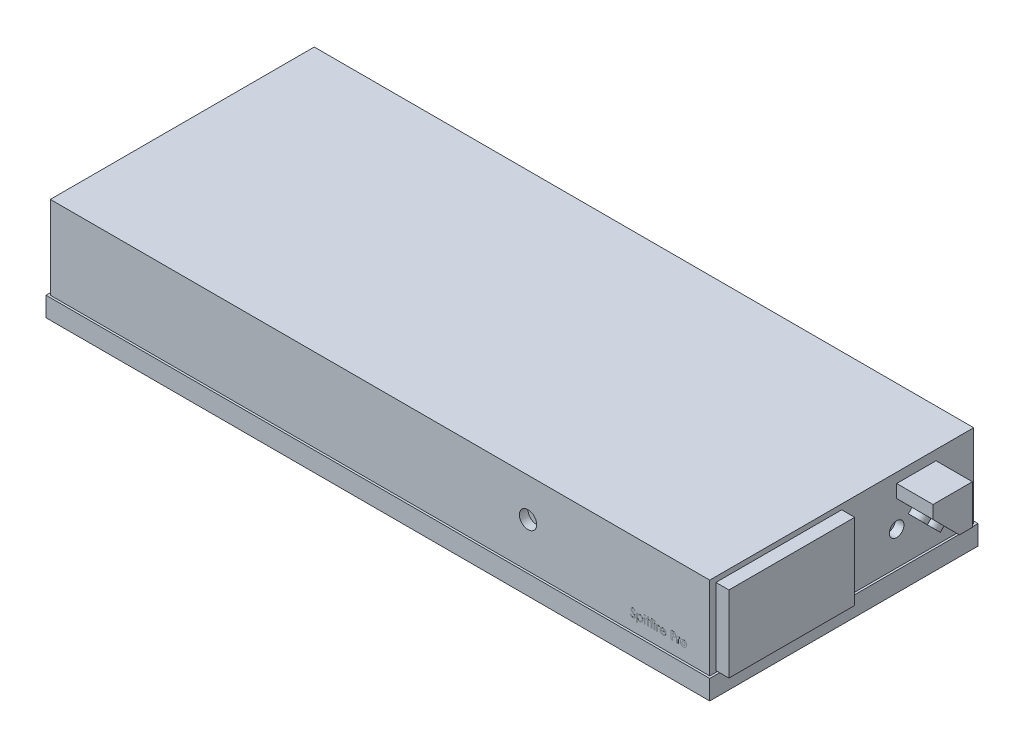
from build123d import *

# Parameters (mm, degrees)
SKETCH_1_W          = 1524
SKETCH_1_H          = 610
EXTRUDE_1_DEPTH     = 237
EXTRUDE_2_DEPTH     = 84
SKETCH_6_R          = 16.880553736
CUT_EXTRUDE_1_DEPTH = 20
SKETCH_7_R          = 20
CUT_EXTRUDE_2_DEPTH = 20
SKETCH_8_W          = 290.679557704
SKETCH_8_H          = 176.432368358
EXTRUDE_3_DEPTH     = 30
SKETCH_9_R          = 18
EXTRUDE_4_DEPTH     = 12
SKETCH_10_W         = 610
SKETCH_10_H         = 45.193860384
EXTRUDE_6_DEPTH     = 5
SKETCH_11_W         = 160
SKETCH_11_H         = 100
EXTRUDE_7_DEPTH     = 20
SKETCH_12_R         = 16
CUT_EXTRUDE_3_DEPTH = 20
SKETCH_13_W         = 610
SKETCH_13_H         = 45.193860384
EXTRUDE_8_DEPTH     = 5
SKETCH_14_W         = 1534
SKETCH_14_H         = 45.193860384
EXTRUDE_9_DEPTH     = 5
SKETCH_15_W         = 1534
SKETCH_15_H         = 45.193860384
EXTRUDE_10_DEPTH    = 5
SKETCH_17_W         = 1.709615384
SKETCH_17_H         = 13.921153846
SKETCH_17_W_2       = 1.709615385
EXTRUDE_11_DEPTH    = 0.1


with BuildPart() as part:
    # 스케치1 → 보스-돌출1 (new body)
    with BuildSketch(Plane(origin=(0, 0, 0), x_dir=(1, 0, 0), z_dir=(0, 1, 0))):
        Rectangle(SKETCH_1_W, SKETCH_1_H)
    extrude(amount=EXTRUDE_1_DEPTH)

    # 스케치2 → 보스-돌출2 (add)
    with BuildSketch(Plane(origin=(762, 0, 0), x_dir=(0, 0, -1), z_dir=(1, 0, 0))):
        Polygon((127, 184.308560686), (127, 214.308560686), (218, 214.308560686), (218, 123), (188, 123), align=None)
    extrude(amount=EXTRUDE_2_DEPTH)

    # 스케치6 → 컷-돌출1 (cut)
    with BuildSketch(Plane(origin=(762, 0, 0), x_dir=(0, 0, -1), z_dir=(1, 0, 0))):
        with Locations((127, 123)):
            Circle(SKETCH_6_R)
    extrude(amount=-CUT_EXTRUDE_1_DEPTH, mode=Mode.SUBTRACT)

    # 스케치7 → 컷-돌출2 (cut)
    with BuildSketch(Plane.XY.offset(305)):
        with Locations((342, 148)):
            Circle(SKETCH_7_R)
    extrude(amount=-CUT_EXTRUDE_2_DEPTH, mode=Mode.SUBTRACT)

    # 스케치8 → 보스-돌출3 (add)
    with BuildSketch(Plane(origin=(762, 0, 0), x_dir=(0, 0, -1), z_dir=(1, 0, 0))):
        with Locations((-145.339778852, 136.93862866)):
            Rectangle(SKETCH_8_W, SKETCH_8_H)
    extrude(amount=EXTRUDE_3_DEPTH)

    # 스케치9 → 보스-돌출4 (add)
    with BuildSketch(Plane(origin=(0, 155.188500395, -155.973501545), x_dir=(1, 0, 0), z_dir=(0, -0.7053206439265453, 0.7088884180539583))):
        with Locations(Location((804, 19.07848224, 0), (0, 0, 90))):
            Circle(SKETCH_9_R)
        with Locations(Location((804, -23.407005638, 0), (0, 0, 90))):
            Circle(SKETCH_9_R)
    extrude(amount=EXTRUDE_4_DEPTH)

    # 스케치10 → 보스-돌출6 (add)
    with BuildSketch(Plane(origin=(762, 0, 0), x_dir=(0, 0, -1), z_dir=(1, 0, 0))):
        with Locations((0, 22.596930192)):
            Rectangle(SKETCH_10_W, SKETCH_10_H)
    extrude(amount=EXTRUDE_6_DEPTH)

    # 스케치11 → 보스-돌출7 (add)
    with BuildSketch(Plane.ZY.offset(762)):
        with Locations((89, 161)):
            Rectangle(SKETCH_11_W, SKETCH_11_H)
    extrude(amount=EXTRUDE_7_DEPTH)

    # 스케치12 → 컷-돌출3 (cut)
    with BuildSketch(Plane.ZY.offset(782)):
        with Locations((89, 161)):
            Circle(SKETCH_12_R)
    extrude(amount=-CUT_EXTRUDE_3_DEPTH, mode=Mode.SUBTRACT)

    # 스케치13 → 보스-돌출8 (add)
    with BuildSketch(Plane.ZY.offset(762)):
        with Locations((0, 22.596930192)):
            Rectangle(SKETCH_13_W, SKETCH_13_H)
    extrude(amount=EXTRUDE_8_DEPTH)

    # 스케치14 → 보스-돌출9 (add)
    with BuildSketch(Plane.XY.offset(305)):
        with Locations((0, 22.596930192)):
            Rectangle(SKETCH_14_W, SKETCH_14_H)
    extrude(amount=EXTRUDE_9_DEPTH)

    # 스케치15 → 보스-돌출10 (add)
    with BuildSketch(Plane(origin=(0, 0, -305), x_dir=(-1, 0, 0), z_dir=(0, 0, -1))):
        with Locations((0, 22.596930192)):
            Rectangle(SKETCH_15_W, SKETCH_15_H)
    extrude(amount=EXTRUDE_10_DEPTH)

    # 스케치17 → 보스-돌출11 (add)
    # profile 1 of 13: a face of its own
    with BuildSketch(Plane.XY.offset(305)):
        with BuildLine():
            Line((578.603701698, 76.91776765), (580.214098333, 77.88324241))
            add(Edge.make_bspline(
                [(580.214098333, 77.88324241), (580.363876167, 77.632520543), (580.650844717, 77.152147122), (581.129551401, 76.503042645), (581.625574817, 75.951342906), (582.14258819, 75.500257371), (582.677435707, 75.145117002), (583.233608914, 74.893644855), (583.80923357, 74.736803617), (584.200976798, 74.717753146), (584.396550256, 74.70824241)],
                knots=[0, 0, 0, 0, 1.272034388, 2.437168799, 3.508375237, 4.49857839, 5.41946034, 6.295179144, 7.148887113, 8, 8, 8, 8], degree=3))
            add(Edge.make_bspline(
                [(584.396550256, 74.70824241), (584.563574454, 74.71289427), (584.894700318, 74.722116595), (585.382174812, 74.810730674), (585.855604336, 74.946868119), (586.30523135, 75.141836332), (586.724851766, 75.377721518), (587.092825351, 75.662634284), (587.410939195, 75.98161949), (587.671157376, 76.337487939), (587.870801568, 76.720214133), (588.024246969, 77.113057525), (588.10940087, 77.522189304), (588.122228342, 77.797654823), (588.128701698, 77.936667891)],
                knots=[0, 0, 0, 0, 1.095163259, 2.171163733, 3.241058638, 4.321873601, 5.38011039, 6.391990106, 7.366004449, 8.327778327, 9.272591725, 10.192022065, 11.087607919, 12, 12, 12, 12], degree=3))
            add(Edge.make_bspline(
                [(588.128701698, 77.936667891), (588.120677236, 78.095277373), (588.104364676, 78.417707272), (587.966489049, 78.893411098), (587.749595291, 79.3641778), (587.549501473, 79.655377546), (587.445618765, 79.806559718)],
                knots=[0, 0, 0, 0, 0.938893495, 1.908633276, 2.914225137, 4, 4, 4, 4], degree=3))
            add(Edge.make_bspline(
                [(587.445618765, 79.806559718), (587.360325851, 79.915671715), (587.181264046, 80.144738704), (586.873429585, 80.485707771), (586.512208306, 80.837416595), (586.109961814, 81.213295176), (585.652037431, 81.595861612), (585.152777674, 82.003358954), (584.599435813, 82.420290394), (584.211362838, 82.69990393), (584.011123573, 82.84417991)],
                knots=[0, 0, 0, 0, 0.722233717, 1.516239348, 2.393582979, 3.351407094, 4.387010283, 5.505090956, 6.712668013, 8, 8, 8, 8], degree=3))
            add(Edge.make_bspline(
                [(584.011123573, 82.84417991), (583.810695823, 82.986938365), (583.427493226, 83.259881661), (582.891597228, 83.664962407), (582.412383793, 84.035315469), (581.99198286, 84.374427306), (581.63057934, 84.682343912), (581.325325346, 84.956108409), (581.083996914, 85.203124647), (580.949800111, 85.363369665), (580.889549054, 85.435315727)],
                knots=[0, 0, 0, 0, 1.452282411, 2.77665338, 3.964542531, 5.026858415, 5.96415736, 6.766646006, 7.446254459, 8, 8, 8, 8], degree=3))
            add(Edge.make_bspline(
                [(580.889549054, 85.435315727), (580.805334201, 85.547444228), (580.639714389, 85.767959973), (580.42109656, 86.112628127), (580.235281973, 86.4654519), (580.089618423, 86.827379392), (579.966957003, 87.193329505), (579.884454552, 87.568076999), (579.832794234, 87.949940337), (579.82750385, 88.206916676), (579.824855544, 88.335556112)],
                knots=[0, 0, 0, 0, 1.068054152, 2.10047183, 3.106115577, 4.101338837, 5.06977816, 6.043150881, 7.020423561, 8, 8, 8, 8], degree=3))
            add(Edge.make_bspline(
                [(579.824855544, 88.335556112), (579.83195961, 88.537103885), (579.846015898, 88.935891489), (579.964890714, 89.518445009), (580.152521749, 90.07463108), (580.415383924, 90.598943325), (580.754241802, 91.077729592), (581.146377749, 91.516497286), (581.613437409, 91.885351997), (582.125896687, 92.207634772), (582.686817798, 92.459889022), (583.274596858, 92.650176643), (583.890168065, 92.757995603), (584.307107983, 92.773468366), (584.51866564, 92.781319333)],
                knots=[0, 0, 0, 0, 1.005424448, 1.989358655, 2.955360095, 3.929531133, 4.905563448, 5.876582895, 6.856512386, 7.866279853, 8.892233794, 9.918561126, 10.94386622, 12, 12, 12, 12], degree=3))
            add(Edge.make_bspline(
                [(584.51866564, 92.781319333), (584.743151386, 92.773576588), (585.189581887, 92.758178739), (585.846258331, 92.62429789), (586.478504516, 92.402769948), (586.987102858, 92.151371681), (587.385154031, 91.900284975), (587.688717047, 91.671577075), (587.996333458, 91.408278269), (588.310484585, 91.10968723), (588.625847317, 90.773064199), (588.947103536, 90.400714592), (589.275004485, 89.99491391), (589.485947095, 89.705220555), (589.594086314, 89.556709958)],
                knots=[0, 0, 0, 0, 1.286793592, 2.559021753, 3.825965368, 5.121522368, 5.803751409, 6.523245864, 7.299691795, 8.125521123, 9.008227632, 9.944561021, 10.946284179, 12, 12, 12, 12], degree=3))
            Line((589.594086314, 89.556709958), (588.048563477, 88.385165487))
            add(Edge.make_bspline(
                [(588.048563477, 88.385165487), (587.955240616, 88.505391073), (587.775522605, 88.736917443), (587.50267497, 89.061155604), (587.245507329, 89.357336728), (586.992140153, 89.614594068), (586.755954816, 89.847015679), (586.526717772, 90.046005213), (586.307727946, 90.213512382), (586.031683046, 90.392275187), (585.684876608, 90.569475585), (585.249532204, 90.719421281), (584.79458405, 90.809528118), (584.484724198, 90.821441921), (584.327860352, 90.827473179)],
                knots=[0, 0, 0, 0, 1.181633172, 2.275549214, 3.290209073, 4.226197932, 5.078386478, 5.862611352, 6.581680152, 7.217281963, 8.414376989, 9.595101626, 10.782541182, 12, 12, 12, 12], degree=3))
            add(Edge.make_bspline(
                [(584.327860352, 90.827473179), (584.131065566, 90.820878069), (583.751565359, 90.808160022), (583.212775645, 90.669258387), (582.727850139, 90.450554262), (582.311185464, 90.144039881), (581.964274203, 89.78088705), (581.713328777, 89.36299071), (581.562288596, 88.901532204), (581.543857559, 88.579632618), (581.534470929, 88.415694333)],
                knots=[0, 0, 0, 0, 1.14458467, 2.207223713, 3.21896685, 4.227309161, 5.202851033, 6.127160689, 7.046193047, 8, 8, 8, 8], degree=3))
            add(Edge.make_bspline(
                [(581.534470929, 88.415694333), (581.536610661, 88.313632714), (581.540893624, 88.109342585), (581.60062788, 87.807528417), (581.677368513, 87.506476699), (581.798976266, 87.207540926), (581.966862847, 86.905493058), (582.187326733, 86.595131886), (582.464984903, 86.273721872), (582.677675499, 86.064676023), (582.789969727, 85.954306112)],
                knots=[0, 0, 0, 0, 0.858281714, 1.717966888, 2.583508476, 3.4729293, 4.427298488, 5.488583878, 6.674047936, 8, 8, 8, 8], degree=3))
            add(Edge.make_bspline(
                [(582.789969727, 85.954306112), (582.831669483, 85.917093157), (582.930738557, 85.828683695), (583.111854667, 85.68394571), (583.35102904, 85.505404906), (583.642016163, 85.284493941), (583.990181375, 85.028236269), (584.395562959, 84.739908465), (584.853642159, 84.410150467), (585.178700016, 84.179604425), (585.350576698, 84.057701545)],
                knots=[0, 0, 0, 0, 0.420754252, 0.999615792, 1.744751191, 2.668019286, 3.750313428, 4.999500688, 6.413464383, 8, 8, 8, 8], degree=3))
            add(Edge.make_bspline(
                [(585.350576698, 84.057701545), (585.557328598, 83.907253573), (585.957674996, 83.615931929), (586.527311252, 83.17824087), (587.043804694, 82.750172301), (587.508968702, 82.334459897), (587.927398732, 81.934256991), (588.294452611, 81.544748823), (588.613870386, 81.168725921), (588.957745846, 80.686638044), (589.309124836, 80.094558143), (589.61088504, 79.36914373), (589.801158331, 78.640909472), (589.826040437, 78.151450547), (589.838317083, 77.90995515)],
                knots=[0, 0, 0, 0, 1.163667725, 2.253281268, 3.268753668, 4.215851969, 5.092017293, 5.902905408, 6.650798638, 7.335211899, 8.59617414, 9.77448103, 10.901945474, 12, 12, 12, 12], degree=3))
            add(Edge.make_bspline(
                [(589.838317083, 77.90995515), (589.834740374, 77.739167192), (589.827656413, 77.400907861), (589.746226297, 76.904219514), (589.626920691, 76.421814352), (589.447103746, 75.959655297), (589.227630556, 75.509287375), (588.949139978, 75.082524374), (588.626336723, 74.669920976), (588.25603866, 74.282479401), (587.850840248, 73.926809392), (587.422576139, 73.610421214), (586.970545368, 73.346615054), (586.49720013, 73.131345471), (586.002431697, 72.962978754), (585.486406474, 72.840988709), (584.948273848, 72.76611834), (584.582511227, 72.758347238), (584.396550256, 72.754396256)],
                knots=[0, 0, 0, 0, 0.983748083, 1.948392443, 2.894712957, 3.844097841, 4.80183111, 5.778335162, 6.776009319, 7.81870978, 8.863265674, 9.881300176, 10.883814829, 11.87499822, 12.874611388, 13.892143829, 14.928324115, 16, 16, 16, 16], degree=3))
            add(Edge.make_bspline(
                [(584.396550256, 72.754396256), (584.25266646, 72.757178545), (583.966710938, 72.762708081), (583.543749329, 72.811591908), (583.129332422, 72.880754857), (582.728660402, 72.990559438), (582.336571061, 73.123784127), (581.954769685, 73.287822766), (581.583071234, 73.484403534), (581.219392676, 73.709166454), (580.864658955, 73.970737892), (580.522197279, 74.275393637), (580.180771284, 74.614731314), (579.850458455, 74.997965952), (579.524577484, 75.418906089), (579.209553569, 75.881490073), (578.898865934, 76.383198241), (578.70392746, 76.736249636), (578.603701698, 76.91776765)],
                knots=[0, 0, 0, 0, 0.915332311, 1.819136955, 2.706846663, 3.586547465, 4.459518054, 5.340707479, 6.227863349, 7.133153174, 8.059268498, 9.028702269, 10.047606654, 11.120612155, 12.245963614, 13.433783089, 14.680604001, 16, 16, 16, 16], degree=3))
        make_face()
    # profile 2 of 13: a face of its own
    with BuildSketch(Plane.XY.offset(305)):
        with BuildLine():
            Line((593.257547852, 87.164011641), (594.967163237, 87.164011641))
            Line((594.967163237, 87.164011641), (594.967163237, 84.588140247))
            add(Edge.make_bspline(
                [(594.967163237, 84.588140247), (595.148723257, 84.821844198), (595.501548822, 85.276001058), (596.109651519, 85.8637759), (596.751510293, 86.359485767), (597.443642581, 86.748010697), (598.175291523, 87.040949687), (598.943454565, 87.25746355), (599.754651271, 87.385052148), (600.309259106, 87.400410047), (600.59210314, 87.40824241)],
                knots=[0, 0, 0, 0, 1.0828784, 2.104357462, 3.088488658, 4.04616522, 5.001424249, 5.969181776, 6.964304535, 8, 8, 8, 8], degree=3))
            add(Edge.make_bspline(
                [(600.59210314, 87.40824241), (600.839163152, 87.401094965), (601.327490244, 87.386967664), (602.046291533, 87.291320039), (602.738488978, 87.127393741), (603.400166529, 86.891168759), (604.038412641, 86.599129701), (604.643778641, 86.23055555), (605.225693851, 85.803801855), (605.769523395, 85.312681148), (606.272015409, 84.781304441), (606.706606766, 84.209683043), (607.081466703, 83.616615251), (607.384472174, 82.992906863), (607.621826179, 82.343469341), (607.790634638, 81.665678827), (607.891096955, 80.962048351), (607.904575928, 80.483606401), (607.911394006, 80.241595775)],
                knots=[0, 0, 0, 0, 1.041296284, 2.058176809, 3.050446431, 4.034000596, 5.01514041, 6.003636468, 7.015969324, 8.052561599, 9.08815499, 10.094063707, 11.074456064, 12.040834395, 13.011057502, 13.983766392, 14.980127149, 16, 16, 16, 16], degree=3))
            add(Edge.make_bspline(
                [(607.911394006, 80.241595775), (607.904723863, 79.994477496), (607.891569379, 79.507124587), (607.789542989, 78.791459101), (607.626492003, 78.103006395), (607.392132463, 77.442911574), (607.089283791, 76.81162913), (606.720777541, 76.209614317), (606.285966913, 75.637060018), (605.789027918, 75.101739233), (605.249896937, 74.608620116), (604.673620887, 74.177338623), (604.069143021, 73.815163423), (603.43955594, 73.512633315), (602.779469965, 73.284620141), (602.091964839, 73.120148969), (601.37741487, 73.018724071), (600.891361457, 73.00537741), (600.645528621, 72.998627025)],
                knots=[0, 0, 0, 0, 1.038740735, 2.04854663, 3.033179607, 4.009277356, 4.987731542, 5.972001279, 6.972200261, 8.005528982, 9.039189865, 10.040446548, 11.026516639, 11.997840187, 12.972163198, 13.956796175, 14.96660207, 16, 16, 16, 16], degree=3))
            add(Edge.make_bspline(
                [(600.645528621, 72.998627025), (600.368881408, 73.005674479), (599.822422056, 73.019595265), (599.023423307, 73.160670912), (598.254473584, 73.371510519), (597.524092096, 73.680115041), (596.826493002, 74.073391492), (596.165622345, 74.552962756), (595.537969732, 75.11782587), (595.160187782, 75.546351898), (594.967163237, 75.765303708)],
                knots=[0, 0, 0, 0, 1.014726462, 2.004382257, 2.969841629, 3.936926163, 4.907207904, 5.903978561, 6.929055279, 8, 8, 8, 8], degree=3))
            Line((594.967163237, 75.765303708), (594.967163237, 68.114011641))
            Line((594.967163237, 68.114011641), (593.257547852, 68.114011641))
            Line((593.257547852, 68.114011641), (593.257547852, 87.164011641))
        make_face()
        with BuildLine():
            add(Edge.make_bspline(
                [(600.576838717, 85.698627025), (600.383184242, 85.695142191), (600.001928494, 85.688281452), (599.443098273, 85.606780387), (598.904824588, 85.488464967), (598.392532253, 85.309330196), (597.90131104, 85.089445227), (597.434944372, 84.814678852), (596.993759611, 84.490001506), (596.578866774, 84.121632506), (596.204053706, 83.715733132), (595.872241198, 83.282548056), (595.593527151, 82.822625868), (595.362194727, 82.34025068), (595.18615486, 81.831641343), (595.061210156, 81.299694516), (594.982667807, 80.743827967), (594.972386592, 80.36524456), (594.967163237, 80.172905872)],
                knots=[0, 0, 0, 0, 1.05670511, 2.080379991, 3.077984906, 4.06214886, 5.038337365, 6.01289324, 7.01187578, 8.025460281, 9.038092164, 10.024533457, 11.000252242, 11.969694649, 12.940728589, 13.933144304, 14.949937299, 16, 16, 16, 16], degree=3))
            add(Edge.make_bspline(
                [(594.967163237, 80.172905872), (594.975822039, 79.920422002), (594.992785367, 79.425784718), (595.130693041, 78.703059711), (595.355130692, 78.0191557), (595.673694119, 77.379832056), (596.076180202, 76.792096911), (596.561128739, 76.265823753), (597.124151767, 75.804320679), (597.75588891, 75.415584998), (598.433100793, 75.099964237), (599.139506971, 74.87400832), (599.865392966, 74.734822334), (600.356166249, 74.717150361), (600.603551458, 74.70824241)],
                knots=[0, 0, 0, 0, 1.03728447, 2.032128127, 3.01272805, 3.987917167, 4.958271349, 5.931593992, 6.91984656, 7.941419022, 8.973179163, 9.983609215, 10.983593296, 12, 12, 12, 12], degree=3))
            add(Edge.make_bspline(
                [(600.603551458, 74.70824241), (600.84595328, 74.716713547), (601.327077321, 74.733527231), (602.035509382, 74.879059366), (602.723979857, 75.101373), (603.378103367, 75.425547157), (603.992185493, 75.822821616), (604.546712235, 76.299398368), (605.03116415, 76.85179363), (605.444082997, 77.466882767), (605.776812938, 78.12642307), (606.026804673, 78.808856056), (606.17108705, 79.511776145), (606.191534713, 79.985292268), (606.201778621, 80.222515247)],
                knots=[0, 0, 0, 0, 1.00104056, 1.986885549, 2.97790532, 3.984399681, 4.995088187, 5.994304198, 6.996462723, 8.023150851, 9.048424203, 10.043036403, 11.019596776, 12, 12, 12, 12], degree=3))
            add(Edge.make_bspline(
                [(606.201778621, 80.222515247), (606.193860713, 80.461211687), (606.178086584, 80.936744883), (606.022709136, 81.637582969), (605.789210686, 82.322773239), (605.448710703, 82.973306517), (605.044843794, 83.587119738), (604.556363711, 84.12897728), (604.008724127, 84.603434798), (603.395373106, 84.995404386), (602.737111647, 85.307201152), (602.044154748, 85.535167815), (601.320017426, 85.672184937), (600.82674405, 85.689735464), (600.576838717, 85.698627025)],
                knots=[0, 0, 0, 0, 0.983928682, 1.960191568, 2.949917689, 3.96440592, 4.982380491, 5.975291189, 6.965713506, 7.964880129, 8.970154049, 9.96478489, 10.968906225, 12, 12, 12, 12], degree=3))
        make_face(mode=Mode.SUBTRACT)
    # profile 3 of 13: a face of its own
    with BuildSketch(Plane.XY.offset(305)):
        with BuildLine():
            add(Edge.make_bspline(
                [(611.933569487, 93.025550102), (612.039657934, 93.02062893), (612.247399489, 93.010992329), (612.547808561, 92.928470576), (612.821350298, 92.788590859), (613.06398053, 92.600922882), (613.272180084, 92.380218054), (613.417943665, 92.122983355), (613.511628278, 91.845078478), (613.522941558, 91.651230635), (613.528701698, 91.552533275)],
                knots=[0, 0, 0, 0, 1.055194115, 2.066272739, 3.074728998, 4.095836921, 5.109056067, 6.073838105, 7.019297344, 8, 8, 8, 8], degree=3))
            add(Edge.make_bspline(
                [(613.528701698, 91.552533275), (613.522811657, 91.456397977), (613.511167742, 91.266349871), (613.418016028, 90.99326283), (613.270937847, 90.739602373), (613.064114035, 90.519326078), (612.821314921, 90.331761847), (612.547817959, 90.191854625), (612.247397017, 90.109340163), (612.039657098, 90.099702557), (611.933569487, 90.094780872)],
                knots=[0, 0, 0, 0, 0.96129708, 1.900370562, 2.859976407, 3.87933698, 4.906634145, 5.921202961, 6.938410037, 8, 8, 8, 8], degree=3))
            add(Edge.make_bspline(
                [(611.933569487, 90.094780872), (611.828695017, 90.099514634), (611.624570565, 90.108728285), (611.328659609, 90.193473668), (611.05745026, 90.331809723), (610.814346827, 90.518097959), (610.611708205, 90.740955185), (610.464215891, 90.993108027), (610.371279312, 91.266389283), (610.359606405, 91.456411217), (610.353701698, 91.552533275)],
                knots=[0, 0, 0, 0, 1.054934014, 2.053291228, 3.073705704, 4.106921865, 5.123545215, 6.088680038, 7.033164197, 8, 8, 8, 8], degree=3))
            add(Edge.make_bspline(
                [(610.353701698, 91.552533275), (610.359477041, 91.6512169), (610.370820179, 91.845037764), (610.464285554, 92.123140729), (610.61047965, 92.378854332), (610.814481003, 92.602150264), (611.057414551, 92.788543274), (611.328668836, 92.926851616), (611.624568128, 93.011604192), (611.82869419, 93.02081685), (611.933569487, 93.025550102)],
                knots=[0, 0, 0, 0, 0.98631895, 1.937192651, 2.907499808, 3.917963147, 4.944918757, 5.95915025, 6.951458133, 8, 8, 8, 8], degree=3))
        make_face()
    # profile 4 of 13: a face of its own
    with BuildSketch(Plane.XY.offset(305)):
        with Locations((611.941201698, 80.203434718)):
            Rectangle(SKETCH_17_W, SKETCH_17_H)
    # profile 5 of 13: a face of its own
    with BuildSketch(Plane.XY.offset(305)):
        Polygon((618.657547852, 92.781319333), (620.367163237, 92.781319333), (620.367163237, 87.164011641), (622.809470929, 87.164011641), (622.809470929, 85.454396256), (620.367163237, 85.454396256), (620.367163237, 73.242857795), (618.657547852, 73.242857795), (618.657547852, 85.454396256), (616.21524016, 85.454396256), (616.21524016, 87.164011641), (618.657547852, 87.164011641), align=None)
    # profile 6 of 13: a face of its own
    with BuildSketch(Plane.XY.offset(305)):
        with BuildLine():
            Line((631.601778621, 92.66683616), (631.601778621, 90.888530872))
            add(Edge.make_bspline(
                [(631.601778621, 90.888530872), (631.439914694, 90.953577762), (631.132693598, 91.077038112), (630.679628122, 91.211284145), (630.263092614, 91.298020102), (629.995555011, 91.310190028), (629.869266602, 91.315934718)],
                knots=[0, 0, 0, 0, 1.16548392, 2.212112691, 3.15604595, 4, 4, 4, 4], degree=3))
            add(Edge.make_bspline(
                [(629.869266602, 91.315934718), (629.783956543, 91.312389566), (629.618824725, 91.305527335), (629.381498047, 91.270539149), (629.167652491, 91.199222475), (628.977666185, 91.106534556), (628.820092966, 90.990306783), (628.685185089, 90.873528848), (628.587395835, 90.741892365), (628.534301049, 90.61931699), (628.501916044, 90.505828011), (628.492172632, 90.38959979), (628.468306171, 90.246865836), (628.461650609, 90.071803314), (628.44647936, 89.869858561), (628.447821793, 89.636757882), (628.435390727, 89.376169432), (628.437251718, 89.191653588), (628.438226939, 89.09496116)],
                knots=[0, 0, 0, 0, 1.311993654, 2.539582093, 3.670788641, 4.763509788, 5.772417512, 6.671800701, 7.496729179, 8.266799162, 8.712543678, 9.304149002, 10.05334463, 10.934920737, 11.99209668, 13.165090968, 14.514413552, 16, 16, 16, 16], degree=3))
            Line((628.438226939, 89.09496116), (628.438226939, 87.164011641))
            Line((628.438226939, 87.164011641), (631.357547852, 87.164011641))
            Line((631.357547852, 87.164011641), (631.357547852, 85.454396256))
            Line((631.357547852, 85.454396256), (628.434410833, 85.454396256))
            Line((628.434410833, 85.454396256), (628.426778621, 73.242857795))
            Line((628.426778621, 73.242857795), (626.717163237, 73.242857795))
            Line((626.717163237, 73.242857795), (626.717163237, 85.454396256))
            Line((626.717163237, 85.454396256), (624.763317083, 85.454396256))
            Line((624.763317083, 85.454396256), (624.763317083, 87.164011641))
            Line((624.763317083, 87.164011641), (626.717163237, 87.164011641))
            Line((626.717163237, 87.164011641), (626.717163237, 89.388801304))
            add(Edge.make_bspline(
                [(626.717163237, 89.388801304), (626.717300475, 89.512221246), (626.717563754, 89.748990454), (626.736003342, 90.089764693), (626.751764334, 90.404489549), (626.783156709, 90.690721964), (626.819415422, 90.951141687), (626.871319375, 91.181880082), (626.920366981, 91.389153657), (627.009350033, 91.623755262), (627.142276683, 91.889638966), (627.357433895, 92.170620475), (627.615387265, 92.422651688), (627.923498283, 92.634963139), (628.270292839, 92.811395952), (628.656088967, 92.937898039), (629.076686827, 93.009419602), (629.367811486, 93.020056085), (629.518184871, 93.025550102)],
                knots=[0, 0, 0, 0, 1.116398763, 2.141702935, 3.087165306, 3.966655413, 4.746276475, 5.464069668, 6.106083417, 6.67047701, 7.730773247, 8.782666744, 9.856985883, 10.980834087, 12.154321827, 13.366232824, 14.639591414, 16, 16, 16, 16], degree=3))
            add(Edge.make_bspline(
                [(629.518184871, 93.025550102), (629.671002655, 93.020339216), (629.991835485, 93.009399237), (630.493648422, 92.941725978), (631.035738038, 92.82486223), (631.407680693, 92.721024029), (631.601778621, 92.66683616)],
                knots=[0, 0, 0, 0, 0.864728408, 1.815451418, 2.859995356, 4, 4, 4, 4], degree=3))
        make_face()
    # profile 7 of 13: a face of its own
    with BuildSketch(Plane.XY.offset(305)):
        with BuildLine():
            add(Edge.make_bspline(
                [(634.647031025, 93.025550102), (634.753119472, 93.02062893), (634.960861028, 93.010992329), (635.261270099, 92.928470576), (635.534811836, 92.788590859), (635.777442068, 92.600922882), (635.985641623, 92.380218054), (636.131405204, 92.122983355), (636.225089817, 91.845078478), (636.236403096, 91.651230635), (636.242163237, 91.552533275)],
                knots=[0, 0, 0, 0, 1.055194115, 2.066272739, 3.074728998, 4.095836921, 5.109056067, 6.073838105, 7.019297344, 8, 8, 8, 8], degree=3))
            add(Edge.make_bspline(
                [(636.242163237, 91.552533275), (636.236273195, 91.456397977), (636.224629281, 91.266349871), (636.131477566, 90.99326283), (635.984399386, 90.739602373), (635.777575573, 90.519326078), (635.53477646, 90.331761847), (635.261279497, 90.191854625), (634.960858556, 90.109340163), (634.753118637, 90.099702557), (634.647031025, 90.094780872)],
                knots=[0, 0, 0, 0, 0.96129708, 1.900370562, 2.859976407, 3.87933698, 4.906634145, 5.921202961, 6.938410037, 8, 8, 8, 8], degree=3))
            add(Edge.make_bspline(
                [(634.647031025, 90.094780872), (634.542156556, 90.099514634), (634.338032104, 90.108728285), (634.042121148, 90.193473668), (633.770911798, 90.331809723), (633.527808366, 90.518097959), (633.325169743, 90.740955185), (633.177677429, 90.993108027), (633.084740851, 91.266389283), (633.073067944, 91.456411217), (633.067163237, 91.552533275)],
                knots=[0, 0, 0, 0, 1.054934014, 2.053291228, 3.073705704, 4.106921865, 5.123545215, 6.088680038, 7.033164197, 8, 8, 8, 8], degree=3))
            add(Edge.make_bspline(
                [(633.067163237, 91.552533275), (633.072938579, 91.6512169), (633.084281717, 91.845037764), (633.177747092, 92.123140729), (633.323941189, 92.378854332), (633.527942542, 92.602150264), (633.77087609, 92.788543274), (634.042130374, 92.926851616), (634.338029667, 93.011604192), (634.542155729, 93.02081685), (634.647031025, 93.025550102)],
                knots=[0, 0, 0, 0, 0.98631895, 1.937192651, 2.907499808, 3.917963147, 4.944918757, 5.95915025, 6.951458133, 8, 8, 8, 8], degree=3))
        make_face()
    # profile 8 of 13: a face of its own
    with BuildSketch(Plane.XY.offset(305)):
        with Locations((634.654663237, 80.203434718)):
            Rectangle(SKETCH_17_W_2, SKETCH_17_H)
    # profile 9 of 13: a face of its own
    with BuildSketch(Plane.XY.offset(305)):
        with BuildLine():
            Line((639.172932467, 87.164011641), (640.882547852, 87.164011641))
            Line((640.882547852, 87.164011641), (640.882547852, 85.114762843))
            add(Edge.make_bspline(
                [(640.882547852, 85.114762843), (641.008760953, 85.305566708), (641.250142529, 85.670477619), (641.651351473, 86.153091957), (642.062305319, 86.552679568), (642.484971409, 86.871105863), (642.922457925, 87.10957441), (643.365163333, 87.284252215), (643.820052676, 87.38754303), (644.125734007, 87.401333374), (644.278881987, 87.40824241)],
                knots=[0, 0, 0, 0, 1.2804753, 2.448899062, 3.506932113, 4.484331642, 5.4025378, 6.288909075, 7.142734305, 8, 8, 8, 8], degree=3))
            add(Edge.make_bspline(
                [(644.278881987, 87.40824241), (644.397679564, 87.401762544), (644.642113299, 87.388429798), (645.012132823, 87.294753738), (645.393369326, 87.145194787), (645.639072891, 87.004550146), (645.767163237, 86.931229189)],
                knots=[0, 0, 0, 0, 0.901110191, 1.854092781, 2.881294221, 4, 4, 4, 4], degree=3))
            Line((645.767163237, 86.931229189), (644.828401217, 85.45058015))
            add(Edge.make_bspline(
                [(644.828401217, 85.45058015), (644.746164974, 85.487266456), (644.59006484, 85.556904087), (644.36171213, 85.639319885), (644.15117514, 85.687847941), (644.017043772, 85.695199703), (643.954512996, 85.698627025)],
                knots=[0, 0, 0, 0, 1.180555205, 2.24091978, 3.179933427, 4, 4, 4, 4], degree=3))
            add(Edge.make_bspline(
                [(643.954512996, 85.698627025), (643.81732179, 85.689482822), (643.537491496, 85.670831298), (643.126640149, 85.524207215), (642.727966073, 85.287305551), (642.411346025, 85.024572785), (642.166187478, 84.771219774), (641.991252821, 84.549976325), (641.830782442, 84.301898345), (641.677455956, 84.03122678), (641.537757983, 83.733340047), (641.407376141, 83.411214271), (641.289490044, 83.064476356), (641.222269429, 82.822908639), (641.187836314, 82.699167891)],
                knots=[0, 0, 0, 0, 1.125678352, 2.296057538, 3.5422874, 4.923748041, 5.663163013, 6.437101912, 7.23742474, 8.08941207, 8.991984279, 9.93940061, 10.944477711, 12, 12, 12, 12], degree=3))
            add(Edge.make_bspline(
                [(641.187836314, 82.699167891), (641.162078573, 82.588802132), (641.105027133, 82.344350362), (641.049556049, 81.934239106), (640.994749101, 81.449696049), (640.956123221, 80.889372451), (640.920319878, 80.254667577), (640.90012643, 79.544614502), (640.883236479, 78.758484405), (640.882784358, 78.208895425), (640.882547852, 77.921403468)],
                knots=[0, 0, 0, 0, 0.566838948, 1.255505196, 2.06880316, 3.007127437, 4.065329342, 5.249902469, 6.561414163, 8, 8, 8, 8], degree=3))
            Line((640.882547852, 77.921403468), (640.882547852, 73.242857795))
            Line((640.882547852, 73.242857795), (639.172932467, 73.242857795))
            Line((639.172932467, 73.242857795), (639.172932467, 87.164011641))
        make_face()
    # profile 10 of 13: a face of its own
    with BuildSketch(Plane.XY.offset(305)):
        with BuildLine():
            Line((658.902199294, 77.639011641), (660.42100939, 76.841445535))
            add(Edge.make_bspline(
                [(660.42100939, 76.841445535), (660.299978779, 76.626761118), (660.064501139, 76.209070258), (659.659548497, 75.635219703), (659.235048787, 75.118977135), (658.771840047, 74.674134303), (658.283780795, 74.286323193), (657.768164488, 73.947027319), (657.22230678, 73.657910801), (656.646181849, 73.414329185), (656.034951435, 73.227043224), (655.387134325, 73.094758822), (654.701489471, 73.012989317), (654.231519549, 73.003490765), (653.990871169, 72.998627025)],
                knots=[0, 0, 0, 0, 1.120438281, 2.179929193, 3.190490725, 4.156257408, 5.095198341, 6.022838206, 6.959905092, 7.901321166, 8.864066838, 9.862729781, 10.905609505, 12, 12, 12, 12], degree=3))
            add(Edge.make_bspline(
                [(653.990871169, 72.998627025), (653.723398406, 73.004870937), (653.201636532, 73.017050999), (652.442141622, 73.122057127), (651.727062217, 73.293356679), (651.056438517, 73.532654841), (650.431912828, 73.845223562), (649.85224389, 74.226003027), (649.314383327, 74.673037156), (648.835280132, 75.190198084), (648.403966999, 75.743638452), (648.02337075, 76.320341195), (647.705195304, 76.918855316), (647.44637324, 77.535370597), (647.237341046, 78.166001218), (647.091653701, 78.816485063), (647.007671787, 79.4850616), (646.994802448, 79.937348527), (646.988317083, 80.16527366)],
                knots=[0, 0, 0, 0, 1.145258523, 2.234067595, 3.276747158, 4.290159414, 5.277019952, 6.260822364, 7.254936242, 8.264827045, 9.274100331, 10.257902744, 11.220704747, 12.172965371, 13.118907548, 14.062713208, 15.023725156, 16, 16, 16, 16], degree=3))
            add(Edge.make_bspline(
                [(646.988317083, 80.16527366), (646.994081838, 80.379149808), (647.005506821, 80.80302409), (647.077520106, 81.430397983), (647.205145816, 82.040152846), (647.38027695, 82.632795341), (647.606434448, 83.207333185), (647.883106955, 83.764116045), (648.210725468, 84.302551449), (648.463669593, 84.642202792), (648.591081506, 84.813290487)],
                knots=[0, 0, 0, 0, 1.024358464, 2.0301432, 3.019427413, 4.004406732, 4.986367066, 5.972626655, 6.978780325, 8, 8, 8, 8], degree=3))
            add(Edge.make_bspline(
                [(648.591081506, 84.813290487), (648.763661894, 85.019405337), (649.10335576, 85.425105842), (649.677883923, 85.958170158), (650.300003563, 86.404722705), (650.961918271, 86.774875832), (651.671321079, 87.056128111), (652.418675935, 87.26571938), (653.212492626, 87.383165411), (653.755173899, 87.399754334), (654.032848333, 87.40824241)],
                knots=[0, 0, 0, 0, 1.030682036, 2.02871468, 2.997146059, 3.962720338, 4.930598197, 5.918074684, 6.934738563, 8, 8, 8, 8], degree=3))
            add(Edge.make_bspline(
                [(654.032848333, 87.40824241), (654.318313156, 87.400872515), (654.878330066, 87.386414462), (655.694933468, 87.252376847), (656.467605368, 87.039819372), (657.19603657, 86.739625169), (657.880300926, 86.352313894), (658.51595071, 85.872570443), (659.1138568, 85.315123425), (659.461702065, 84.886426528), (659.638707708, 84.668278468)],
                knots=[0, 0, 0, 0, 1.056321875, 2.072262726, 3.055038591, 4.01806755, 4.982017516, 5.957941055, 6.960871419, 8, 8, 8, 8], degree=3))
            add(Edge.make_bspline(
                [(659.638707708, 84.668278468), (659.759141472, 84.503884689), (659.999207357, 84.176191386), (660.29990943, 83.641859802), (660.56093468, 83.08282071), (660.769575511, 82.490037522), (660.938519082, 81.870533807), (661.060748338, 81.219880813), (661.13242869, 80.538272296), (661.1465186, 80.073852044), (661.153701698, 79.837088564)],
                knots=[0, 0, 0, 0, 0.94817472, 1.890038105, 2.849395472, 3.817997239, 4.812318967, 5.836947057, 6.897266129, 8, 8, 8, 8], degree=3))
            Line((661.153701698, 79.837088564), (648.697932467, 79.837088564))
            add(Edge.make_bspline(
                [(648.697932467, 79.837088564), (648.706312325, 79.653661751), (648.722790978, 79.292960322), (648.799617686, 78.765162203), (648.920714583, 78.262387298), (649.090907624, 77.788406741), (649.297011453, 77.337029904), (649.549482283, 76.911605103), (649.850687569, 76.514070083), (650.186651733, 76.140868949), (650.560614638, 75.808523949), (650.954039305, 75.511062138), (651.372559994, 75.261748819), (651.812876706, 75.05938399), (652.274277422, 74.90096247), (652.756907513, 74.79282476), (653.25981726, 74.720396078), (653.602639613, 74.712342472), (653.777169246, 74.70824241)],
                knots=[0, 0, 0, 0, 1.094153842, 2.151609401, 3.174256925, 4.172055639, 5.149267565, 6.128595816, 7.11444997, 8.118368179, 9.117203808, 10.09244225, 11.054858984, 12.015122123, 12.976791628, 13.957293641, 14.960065497, 16, 16, 16, 16], degree=3))
            add(Edge.make_bspline(
                [(653.777169246, 74.70824241), (653.947809064, 74.711551976), (654.286391196, 74.718118788), (654.790622148, 74.781973903), (655.286681576, 74.885226404), (655.772516356, 75.026141921), (656.238266246, 75.198010216), (656.669588454, 75.405398627), (657.066265056, 75.634813677), (657.437015975, 75.897212051), (657.796630953, 76.218385184), (658.153369343, 76.619173893), (658.535875128, 77.093178866), (658.775304197, 77.449934562), (658.902199294, 77.639011641)],
                knots=[0, 0, 0, 0, 0.99110716, 1.966546729, 2.947904876, 3.932708344, 4.903319531, 5.828989031, 6.710028674, 7.56322171, 8.463672341, 9.504779593, 10.677557249, 12, 12, 12, 12], degree=3))
        make_face()
        with BuildLine():
            add(Edge.make_bspline(
                [(659.444086314, 81.546703948), (659.381511828, 81.773469018), (659.261076088, 82.209918782), (659.009418161, 82.814298485), (658.726000204, 83.351442632), (658.390601923, 83.817240349), (658.010588574, 84.230916613), (657.571648365, 84.592423484), (657.079418716, 84.915824182), (656.536443965, 85.188797072), (655.96145082, 85.421151874), (655.359437118, 85.57695429), (654.745168302, 85.683686227), (654.329691686, 85.693625474), (654.120618765, 85.698627025)],
                knots=[0, 0, 0, 0, 1.154881502, 2.222775134, 3.210006277, 4.132804581, 5.035138423, 5.962687519, 6.919655026, 7.923214229, 8.944639381, 9.960483929, 10.97369054, 12, 12, 12, 12], degree=3))
            add(Edge.make_bspline(
                [(654.120618765, 85.698627025), (653.94998825, 85.695297785), (653.612687595, 85.688716575), (653.115748923, 85.6262863), (652.638520848, 85.523090573), (652.177482068, 85.381767023), (651.738674199, 85.193397344), (651.313071246, 84.972508639), (650.911495089, 84.702860876), (650.66035461, 84.497344823), (650.533479342, 84.393518852)],
                knots=[0, 0, 0, 0, 1.04873581, 2.073130211, 3.073294108, 4.04793562, 5.032784715, 6.005352987, 6.992311501, 8, 8, 8, 8], degree=3))
            add(Edge.make_bspline(
                [(650.533479342, 84.393518852), (650.442620193, 84.311362649), (650.25874342, 84.145098516), (650.01305001, 83.858645263), (649.777807152, 83.549754617), (649.563719699, 83.206609011), (649.36735455, 82.833115913), (649.183603817, 82.432425642), (649.018214917, 82.001497604), (648.925163232, 81.701201899), (648.877289439, 81.546703948)],
                knots=[0, 0, 0, 0, 0.879870761, 1.780643979, 2.707998968, 3.669668524, 4.684282772, 5.740141944, 6.837334558, 8, 8, 8, 8], degree=3))
            Line((648.877289439, 81.546703948), (659.444086314, 81.546703948))
        make_face(mode=Mode.SUBTRACT)
    # profile 11 of 13: a face of its own
    with BuildSketch(Plane.XY.offset(305)):
        with BuildLine():
            Line((672.144086314, 92.292857795), (675.960192083, 92.292857795))
            add(Edge.make_bspline(
                [(675.960192083, 92.292857795), (676.209531483, 92.291741698), (676.690559451, 92.289588515), (677.384241357, 92.2634783), (678.02419688, 92.216687204), (678.610278991, 92.15886081), (679.142246707, 92.077790455), (679.620766212, 91.984849641), (680.045936811, 91.871620679), (680.422552932, 91.73721947), (680.760553737, 91.578765697), (681.080411513, 91.410001117), (681.37489744, 91.208586544), (681.658875112, 90.996229584), (681.916109036, 90.752643859), (682.162647004, 90.494040352), (682.388047461, 90.21016306), (682.593354828, 89.904448242), (682.779600246, 89.582544201), (682.942316702, 89.243875468), (683.074303179, 88.887906134), (683.185023422, 88.516938917), (683.273954999, 88.130989984), (683.333150688, 87.727685714), (683.373359378, 87.309842133), (683.37690724, 87.025457528), (683.378701698, 86.881619814)],
                knots=[0, 0, 0, 0, 1.698747864, 3.27724071, 4.728299578, 6.070144658, 7.288476769, 8.393259625, 9.389771311, 10.283485332, 11.113357557, 11.931608583, 12.74405601, 13.541433047, 14.344816069, 15.154114104, 15.974336324, 16.810834471, 17.661136416, 18.50621059, 19.367396281, 20.244825668, 21.142564693, 22.063065223, 23.020325768, 24, 24, 24, 24], degree=3))
            add(Edge.make_bspline(
                [(683.378701698, 86.881619814), (683.376105342, 86.722495576), (683.371003182, 86.409796895), (683.320985577, 85.951418991), (683.235539704, 85.514397162), (683.123866417, 85.095045922), (682.96814596, 84.70026453), (682.790242651, 84.32063338), (682.571365151, 83.966796165), (682.321262617, 83.634326807), (682.048122117, 83.320522173), (681.745459307, 83.034442779), (681.41904307, 82.774138431), (681.070762914, 82.53688112), (680.69931129, 82.323149446), (680.304956219, 82.130942039), (679.88500482, 81.966406288), (679.592563301, 81.880355423), (679.44429665, 81.836727987)],
                knots=[0, 0, 0, 0, 1.102006807, 2.165578795, 3.188629044, 4.184801286, 5.166646146, 6.124351954, 7.085497154, 8.042432466, 9.003981491, 9.963833307, 10.922997304, 11.89326795, 12.880200226, 13.889073926, 14.929769137, 16, 16, 16, 16], degree=3))
            add(Edge.make_bspline(
                [(679.44429665, 81.836727987), (679.346639705, 81.812430781), (679.135083314, 81.759795208), (678.785015594, 81.706356891), (678.381599303, 81.657223644), (677.923529931, 81.614999567), (677.41054339, 81.586297033), (676.843136386, 81.56388163), (676.221051778, 81.547583318), (675.788478742, 81.547004982), (675.563317083, 81.546703948)],
                knots=[0, 0, 0, 0, 0.618981996, 1.340914327, 2.176866532, 3.120127938, 4.170906482, 5.338178032, 6.614476169, 8, 8, 8, 8], degree=3))
            Line((675.563317083, 81.546703948), (675.563317083, 73.242857795))
            Line((675.563317083, 73.242857795), (672.144086314, 73.242857795))
            Line((672.144086314, 73.242857795), (672.144086314, 92.292857795))
        make_face()
        with BuildLine():
            Line((675.563317083, 84.965934718), (676.773022612, 84.965934718))
            add(Edge.make_bspline(
                [(676.773022612, 84.965934718), (676.993147631, 84.967330481), (677.398180937, 84.969898707), (677.951313403, 85.007036741), (678.395821292, 85.06375402), (678.746990779, 85.145099716), (679.02427235, 85.26855258), (679.263410346, 85.411364297), (679.46852511, 85.591945792), (679.646124306, 85.798291049), (679.788109511, 86.035392091), (679.886568855, 86.299388189), (679.950526109, 86.584732501), (679.956433156, 86.783313255), (679.959470929, 86.88543592)],
                knots=[0, 0, 0, 0, 1.8619151, 3.425951444, 4.686033666, 5.651700536, 6.461346321, 7.243864085, 7.999046032, 8.762387399, 9.539336099, 10.322741239, 11.137448474, 12, 12, 12, 12], degree=3))
            add(Edge.make_bspline(
                [(679.959470929, 86.88543592), (679.956464403, 86.974659161), (679.950631021, 87.147773702), (679.907777403, 87.397620924), (679.839481064, 87.630530077), (679.740522294, 87.844068731), (679.612592037, 88.037874051), (679.456619164, 88.211869691), (679.274605115, 88.369781914), (679.134079628, 88.453367266), (679.062686073, 88.495832554)],
                knots=[0, 0, 0, 0, 1.102301479, 2.1387299, 3.123554645, 4.094223062, 5.036071848, 5.982632524, 6.975082478, 8, 8, 8, 8], degree=3))
            add(Edge.make_bspline(
                [(679.062686073, 88.495832554), (679.002211611, 88.526416224), (678.874174784, 88.591168119), (678.656115652, 88.666446932), (678.404478744, 88.729952903), (678.117565227, 88.782662246), (677.796519682, 88.82357017), (677.441399387, 88.854854499), (677.051681751, 88.867435146), (676.780656454, 88.871506138), (676.63945891, 88.873627025)],
                knots=[0, 0, 0, 0, 0.656809284, 1.390599849, 2.23162475, 3.173112763, 4.218524733, 5.370385145, 6.63003504, 8, 8, 8, 8], degree=3))
            Line((676.63945891, 88.873627025), (675.563317083, 88.873627025))
            Line((675.563317083, 88.873627025), (675.563317083, 84.965934718))
        make_face(mode=Mode.SUBTRACT)
    # profile 12 of 13: a face of its own
    with BuildSketch(Plane.XY.offset(305)):
        with BuildLine():
            Line((685.82100939, 87.164011641), (688.751778621, 87.164011641))
            Line((688.751778621, 87.164011641), (688.751778621, 85.45058015))
            add(Edge.make_bspline(
                [(688.751778621, 85.45058015), (688.834684456, 85.602853278), (688.996727351, 85.900477424), (689.294413738, 86.299978901), (689.636407917, 86.636427898), (690.010420979, 86.916861553), (690.417586484, 87.135432051), (690.847001266, 87.291191085), (691.294991689, 87.392412875), (691.600595568, 87.402927904), (691.755053862, 87.40824241)],
                knots=[0, 0, 0, 0, 1.09866127, 2.147379032, 3.14564304, 4.131443017, 5.102343063, 6.064490016, 7.021754664, 8, 8, 8, 8], degree=3))
            add(Edge.make_bspline(
                [(691.755053862, 87.40824241), (691.867209856, 87.402990568), (692.095599509, 87.392295942), (692.44369748, 87.330127922), (692.796817892, 87.217716319), (693.029201553, 87.11650461), (693.147932467, 87.064792891)],
                knots=[0, 0, 0, 0, 0.931404136, 1.896671404, 2.925354185, 4, 4, 4, 4], degree=3))
            Line((693.147932467, 87.064792891), (692.087055064, 84.168368612))
            add(Edge.make_bspline(
                [(692.087055064, 84.168368612), (691.992227773, 84.214184574), (691.813988971, 84.300300945), (691.555217178, 84.401927135), (691.320371047, 84.46393447), (691.171482911, 84.473186507), (691.102499775, 84.477473179)],
                knots=[0, 0, 0, 0, 1.214386998, 2.282580073, 3.20428172, 4, 4, 4, 4], degree=3))
            add(Edge.make_bspline(
                [(691.102499775, 84.477473179), (691.03736628, 84.474632604), (690.909237473, 84.469044703), (690.720122938, 84.421158291), (690.542016428, 84.338579657), (690.366334998, 84.232788232), (690.206937966, 84.085730239), (690.04763939, 83.915484501), (689.907256955, 83.705293493), (689.759112774, 83.471340226), (689.632973301, 83.184981639), (689.524812587, 82.843128496), (689.428440523, 82.441825324), (689.362123384, 81.978941398), (689.298025208, 81.458955919), (689.259872399, 80.878052258), (689.231436628, 80.238067289), (689.229697971, 79.791334684), (689.228791842, 79.558512843)],
                knots=[0, 0, 0, 0, 0.544232178, 1.070598461, 1.618251235, 2.182094276, 2.777567932, 3.425210017, 4.127676488, 4.886675562, 5.738955394, 6.734782583, 7.883056018, 9.186093582, 10.642914445, 12.264202625, 14.053029461, 16, 16, 16, 16], degree=3))
            Line((689.228791842, 79.558512843), (689.24024016, 78.879246016))
            Line((689.24024016, 78.879246016), (689.24024016, 73.242857795))
            Line((689.24024016, 73.242857795), (685.82100939, 73.242857795))
            Line((685.82100939, 73.242857795), (685.82100939, 87.164011641))
        make_face()
    # profile 13 of 13: a face of its own
    with BuildSketch(Plane.XY.offset(305)):
        with BuildLine():
            add(Edge.make_bspline(
                [(701.489939679, 87.40824241), (701.651594309, 87.405365655), (701.971743725, 87.399668377), (702.448566286, 87.352243741), (702.91705289, 87.274868492), (703.379896334, 87.174681051), (703.832798685, 87.03430346), (704.278135361, 86.865942247), (704.719888237, 86.672643884), (705.147093096, 86.442551222), (705.562836173, 86.192994745), (705.956985352, 85.917713475), (706.326267497, 85.618869653), (706.67753774, 85.303392207), (706.994426322, 84.95754628), (707.297184123, 84.597996177), (707.569453877, 84.211860474), (707.821536449, 83.808548405), (708.045963749, 83.390392245), (708.240837585, 82.960300836), (708.409969753, 82.524220498), (708.542396851, 82.076839472), (708.652034282, 81.624057072), (708.721223293, 81.160324788), (708.770411883, 80.690406316), (708.775927483, 80.37401853), (708.778701698, 80.214883035)],
                knots=[0, 0, 0, 0, 1.022364134, 2.024744242, 3.027414945, 4.024939316, 5.017584196, 6.023349371, 7.035562955, 8.064994934, 9.090267829, 10.101425541, 11.102933353, 12.093946398, 13.084502048, 14.067315274, 15.065326281, 16.070028806, 17.074376865, 18.064572984, 19.055292013, 20.030201733, 21.013838017, 21.999348303, 22.993720005, 24, 24, 24, 24], degree=3))
            add(Edge.make_bspline(
                [(708.778701698, 80.214883035), (708.775773974, 80.054504293), (708.769952994, 79.735634998), (708.723002876, 79.261296362), (708.645331459, 78.795383361), (708.544759494, 78.335151224), (708.404907236, 77.886489058), (708.241504801, 77.442783408), (708.040921883, 77.010082147), (707.819162687, 76.583664912), (707.565459331, 76.176079862), (707.293425257, 75.786076011), (706.991935555, 75.423884994), (706.677583754, 75.078274258), (706.335459437, 74.760930813), (705.971023548, 74.466701847), (705.587431089, 74.191990279), (705.181923626, 73.94324136), (704.75969503, 73.724674556), (704.327866111, 73.527618746), (703.883911771, 73.363555714), (703.428750798, 73.229766829), (702.962107153, 73.126177444), (702.485011064, 73.055807942), (701.998490019, 73.006866766), (701.670691296, 73.001391287), (701.505204102, 72.998627025)],
                knots=[0, 0, 0, 0, 1.012026251, 2.012137606, 3.004615893, 3.992048833, 4.982446996, 5.968083444, 6.973977695, 7.990229942, 8.999482246, 10.001782172, 10.988562221, 11.971415814, 12.948383116, 13.930088534, 14.925840678, 15.924049238, 16.929462851, 17.924729459, 18.917889337, 19.913673841, 20.916777188, 21.931792057, 22.95587778, 24, 24, 24, 24], degree=3))
            add(Edge.make_bspline(
                [(701.505204102, 72.998627025), (701.263228079, 73.005729499), (700.786289653, 73.019728582), (700.083872111, 73.11561864), (699.409080726, 73.28067057), (698.760815932, 73.510749322), (698.138235618, 73.805586669), (697.546773167, 74.170492658), (696.98054514, 74.598283337), (696.449359032, 75.085342981), (695.962720599, 75.619691516), (695.537583377, 76.190105321), (695.176607473, 76.788034852), (694.880117653, 77.41416195), (694.651287972, 78.069345205), (694.486033899, 78.751625847), (694.390026605, 79.462921669), (694.376145921, 79.946196569), (694.369086314, 80.1919864)],
                knots=[0, 0, 0, 0, 1.029999031, 2.030143771, 3.011211297, 3.982305373, 4.953580601, 5.938004764, 6.935448627, 7.970290061, 9.001484052, 10.007591832, 10.993831261, 11.969999897, 12.951306496, 13.942897864, 14.953773953, 16, 16, 16, 16], degree=3))
            add(Edge.make_bspline(
                [(694.369086314, 80.1919864), (694.376392111, 80.454436061), (694.390751508, 80.970275613), (694.504771446, 81.725992313), (694.686848985, 82.449555237), (694.948209824, 83.138940353), (695.282075308, 83.795419136), (695.6896494, 84.417607002), (696.172946357, 85.005644882), (696.543055049, 85.36131035), (696.731255785, 85.542166689)],
                knots=[0, 0, 0, 0, 1.043912699, 2.05178951, 3.033892, 4.007821512, 4.978932272, 5.95884105, 6.962068106, 8, 8, 8, 8], degree=3))
            add(Edge.make_bspline(
                [(696.731255785, 85.542166689), (696.903948772, 85.69207625), (697.244636286, 85.987816782), (697.798141367, 86.362915162), (698.364868112, 86.686885726), (698.951608985, 86.953249785), (699.559999668, 87.154083989), (700.186922504, 87.30027332), (700.832247133, 87.390067091), (701.269594725, 87.402153182), (701.489939679, 87.40824241)],
                knots=[0, 0, 0, 0, 1.048115528, 2.067714963, 3.060638214, 4.039924844, 5.017819947, 5.994373833, 6.98952318, 8, 8, 8, 8], degree=3))
        make_face()
        with BuildLine():
            add(Edge.make_bspline(
                [(701.566261794, 84.23324241), (701.433878562, 84.22884243), (701.173280744, 84.220181021), (700.78967391, 84.173697556), (700.426854526, 84.078425703), (700.077616324, 83.957265979), (699.748137361, 83.795231919), (699.429394383, 83.605614729), (699.137961322, 83.368332149), (698.859734802, 83.108050518), (698.607167139, 82.819014752), (698.391955506, 82.504110501), (698.199659145, 82.175385341), (698.053850566, 81.820804236), (697.933180028, 81.450058916), (697.851511654, 81.057159263), (697.794676169, 80.646494182), (697.79045694, 80.365185787), (697.788317083, 80.222515247)],
                knots=[0, 0, 0, 0, 1.030650113, 2.02884584, 2.99876339, 3.944280128, 4.900564847, 5.851248946, 6.823638398, 7.81794922, 8.81432732, 9.802856497, 10.78262424, 11.771747962, 12.779760563, 13.812642396, 14.89064281, 16, 16, 16, 16], degree=3))
            add(Edge.make_bspline(
                [(697.788317083, 80.222515247), (697.790821006, 80.074813425), (697.795714445, 79.786158579), (697.84638702, 79.364683688), (697.929947767, 78.964706809), (698.048661402, 78.586845822), (698.197963841, 78.228388486), (698.381140621, 77.891345989), (698.600124967, 77.577744838), (698.848400065, 77.287971209), (699.120250694, 77.024940479), (699.41812336, 76.799217349), (699.729544277, 76.603093907), (700.061690274, 76.445576513), (700.409843927, 76.323960305), (700.775038758, 76.234418381), (701.159193868, 76.186177533), (701.421126942, 76.177868054), (701.554813477, 76.173627025)],
                knots=[0, 0, 0, 0, 1.141730614, 2.231293227, 3.276944405, 4.297399982, 5.28939179, 6.275415646, 7.257752684, 8.24146775, 9.222424823, 10.176631434, 11.126518621, 12.063689483, 13.012557477, 13.974037417, 14.965980454, 16, 16, 16, 16], degree=3))
            add(Edge.make_bspline(
                [(701.554813477, 76.173627025), (701.688566875, 76.177388626), (701.950801182, 76.184763547), (702.33540741, 76.239990056), (702.702467195, 76.326905697), (703.053594352, 76.449568614), (703.385949985, 76.610457584), (703.700806381, 76.807519306), (704.000933372, 77.036382042), (704.276432263, 77.304375662), (704.531456316, 77.59505299), (704.755097158, 77.91030962), (704.94197988, 78.247352203), (705.095257175, 78.604060064), (705.214203529, 78.979942912), (705.296380912, 79.376397854), (705.353246784, 79.792196248), (705.357370591, 80.077304097), (705.359470929, 80.222515247)],
                knots=[0, 0, 0, 0, 1.031504075, 2.022346795, 2.991027682, 3.937587355, 4.885570121, 5.833146507, 6.798790848, 7.791235734, 8.792807298, 9.778388351, 10.766749885, 11.760164525, 12.768777521, 13.802286646, 14.880660483, 16, 16, 16, 16], degree=3))
            add(Edge.make_bspline(
                [(705.359470929, 80.222515247), (705.356935152, 80.367675644), (705.351959136, 80.652527433), (705.301282949, 81.068888188), (705.218542244, 81.464061678), (705.098297465, 81.836360542), (704.949882458, 82.190032123), (704.766579067, 82.523266106), (704.54651476, 82.834421229), (704.297032727, 83.121954613), (704.021106888, 83.381294424), (703.72840601, 83.612562579), (703.412236924, 83.80383911), (703.078531152, 83.961519252), (702.726400862, 84.082831613), (702.356241379, 84.172880995), (701.966918278, 84.220435396), (701.701209736, 84.228928789), (701.566261794, 84.23324241)],
                knots=[0, 0, 0, 0, 1.123894411, 2.205445421, 3.243160173, 4.246488011, 5.231014757, 6.210004299, 7.185865357, 8.177612767, 9.153374344, 10.115157457, 11.061423229, 12.009021698, 12.96873347, 13.94135618, 14.954456845, 16, 16, 16, 16], degree=3))
        make_face(mode=Mode.SUBTRACT)
    extrude(amount=EXTRUDE_11_DEPTH)


solid = part.part
